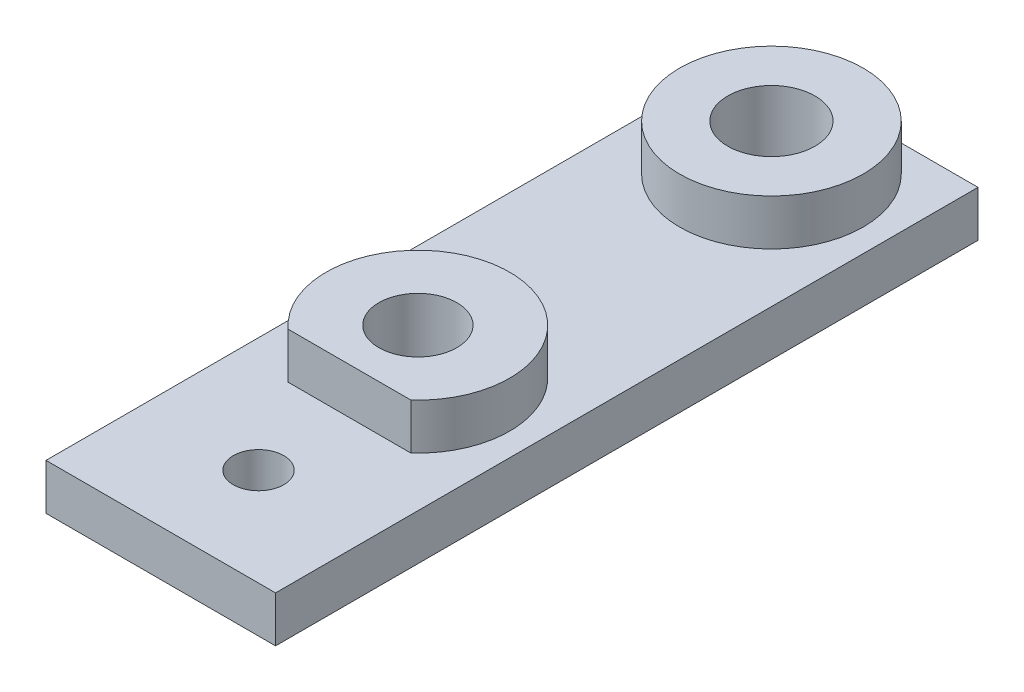
from build123d import *

# Parameters (mm, degrees)
SKETCH_1_W          = 25
SKETCH_1_H          = 76.5
SKETCH_1_R          = 4.75
SKETCH_1_R_2        = 4.25
EXTRUDE_1_DEPTH     = 5
SKETCH_2_R          = 2.75
CUT_EXTRUDE_1_DEPTH = 64.300866763
SKETCH_3_R          = 10
SKETCH_3_R_2        = 4.75
SKETCH_3_R_3        = 4.25
EXTRUDE_2_DEPTH     = 5


with BuildPart() as part:
    # 草图1 → 凸台-拉伸1 (new body)
    with BuildSketch(Plane(origin=(0, 0, 0), x_dir=(1, 0, 0), z_dir=(0, 1, 0))):
        with Locations((-26.981132075, -10.976415094)):
            Rectangle(SKETCH_1_W, SKETCH_1_H)
        with Locations(Location((-26.981132075, 17.273584906, 0), (0, 0, 270))):
            Circle(SKETCH_1_R, mode=Mode.SUBTRACT)
        with Locations(Location((-26.981132075, -21.226415094, 0), (0, 0, 270))):
            Circle(SKETCH_1_R_2, mode=Mode.SUBTRACT)
    extrude(amount=EXTRUDE_1_DEPTH)

    # 草图2 → 切除-拉伸1 (cut, through all)
    with BuildSketch(Plane(origin=(0, 0, 0), x_dir=(-1, 0, 0), z_dir=(0, -1, 0))):
        with Locations(Location((26.981132075, -38.580008519, 0), (0, 0, 90))):
            Circle(SKETCH_2_R)
    extrude(amount=-CUT_EXTRUDE_1_DEPTH, mode=Mode.SUBTRACT)

    # 草图3 → 凸台-拉伸2 (add)
    # profile 1 of 2: a face of its own
    with BuildSketch(Plane(origin=(0, 5, 0), x_dir=(1, 0, 0), z_dir=(0, 1, 0))):
        with Locations(Location((-26.981132075, 17.273584906, 0), (0, 0, 90))):
            Circle(SKETCH_3_R)
        with Locations(Location((-26.981132075, 17.273584906, 0), (0, 0, 270))):
            Circle(SKETCH_3_R_2, mode=Mode.SUBTRACT)
    # profile 2 of 2: a face of its own
    with BuildSketch(Plane(origin=(0, 5, 0), x_dir=(1, 0, 0), z_dir=(0, 1, 0))):
        with BuildLine():
            Line((-33.65845117, -28.670433479), (-20.303812981, -28.670433479))
            ThreePointArc((-20.303812981, -28.670433479), (-26.981132075, -11.226415094), (-33.65845117, -28.670433479))
        make_face()
        with Locations(Location((-26.981132075, -21.226415094, 0), (0, 0, 270))):
            Circle(SKETCH_3_R_3, mode=Mode.SUBTRACT)
    extrude(amount=EXTRUDE_2_DEPTH)


solid = part.part
